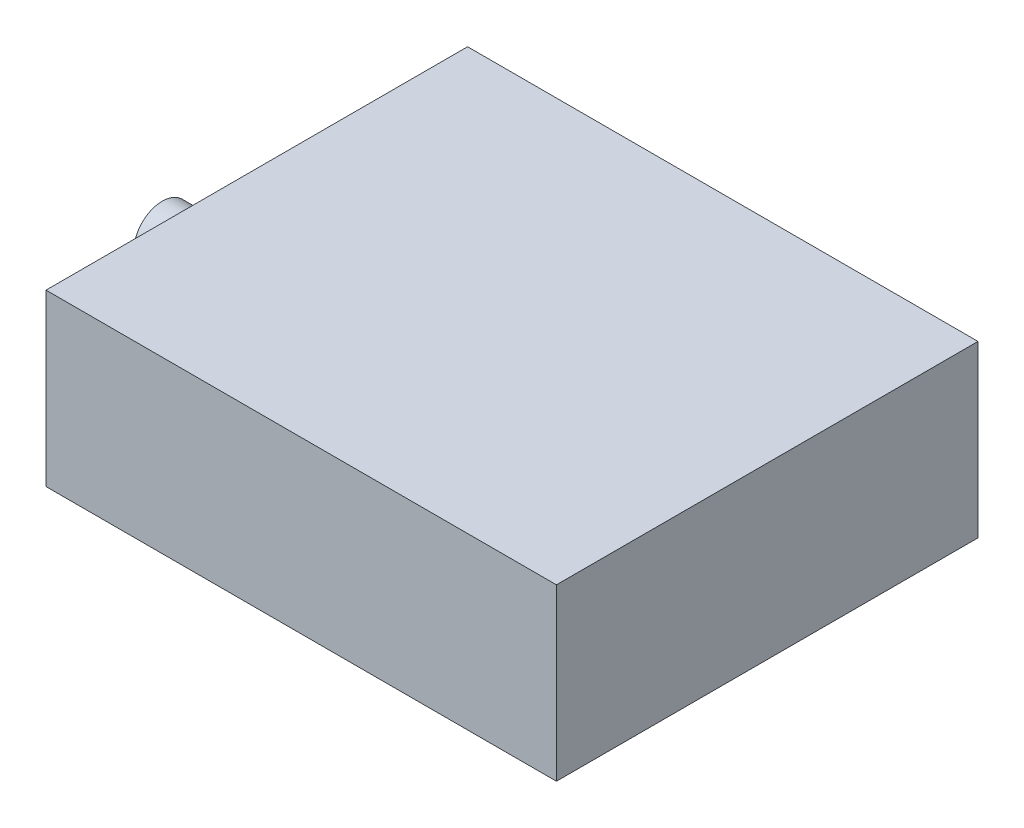
from build123d import *

# Parameters (mm, degrees)
SKETCH1_W           = 27
SKETCH1_H           = 22.3
BOSS_EXTRUDE1_DEPTH = 9
SKETCH2_R           = 1.5
BOSS_EXTRUDE3_DEPTH = 5


with BuildPart() as part:
    # Sketch1 → Boss-Extrude1 (new body)
    with BuildSketch(Plane(origin=(0, 0, 0), x_dir=(1, 0, 0), z_dir=(0, 1, 0))):
        Rectangle(SKETCH1_W, SKETCH1_H)
    extrude(amount=BOSS_EXTRUDE1_DEPTH)

    # Sketch2 → Boss-Extrude3 (add)
    with BuildSketch(Plane.ZY.offset(13.5)):
        with Locations(Location((0, 3.5, 0), (0, 0, 180))):
            Circle(SKETCH2_R)
    extrude(amount=BOSS_EXTRUDE3_DEPTH)


solid = part.part
